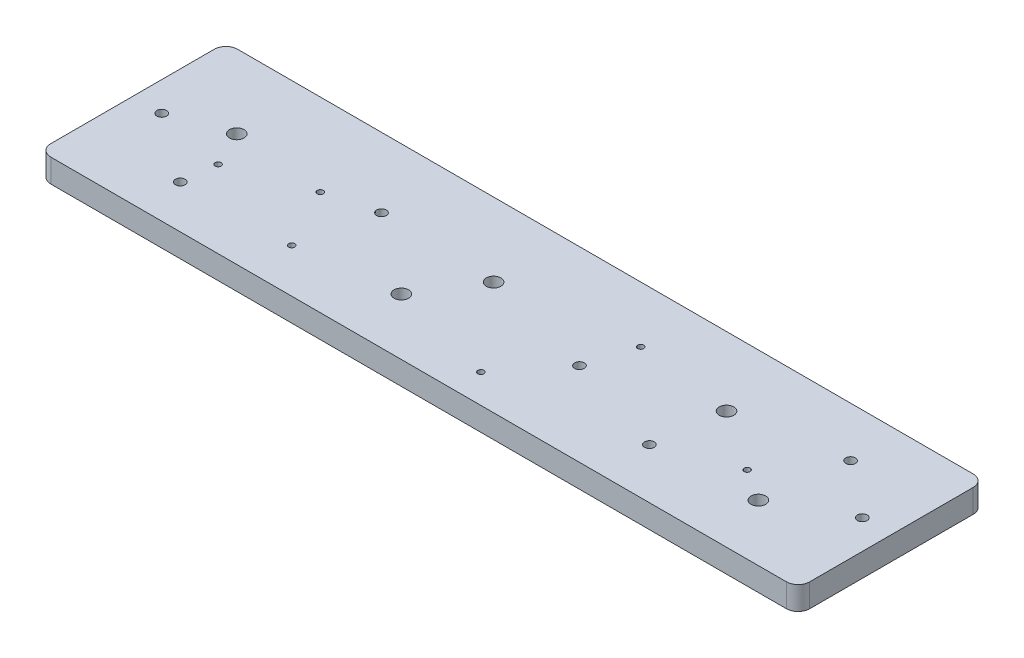
from build123d import *

# Parameters (mm, degrees)
SKETCH1_W                    = 650
SKETCH1_H                    = 160
BOSS_EXTRUDE1_DEPTH          = 20
FILLET1_R                    = 10
F_12_5_12_5_DIAMETER_HOLE1_D = 12.5
F_8_3_8_3_DIAMETER_HOLE1_D   = 8.3
F_5_2_5_2_DIAMETER_HOLE1_D   = 5.2
M8_CLEARANCE_HOLE1_D         = 8.4


with BuildPart() as part:
    # Sketch1 → Boss-Extrude1 (new body)
    with BuildSketch(Plane(origin=(0, 0, 0), x_dir=(1, 0, 0), z_dir=(0, 1, 0))):
        with Locations((325, 80)):
            Rectangle(SKETCH1_W, SKETCH1_H)
    extrude(amount=BOSS_EXTRUDE1_DEPTH)

    # Fillet1
    fillet1_edges = [part.edges().sort_by_distance(p)[0] for p in [
        (0, 10, 0),
        (650, 10, 0),
        (650, 10, -160),
        (0, 10, -160),
    ]]
    fillet(fillet1_edges, radius=FILLET1_R)

    # Ø12.5 (12.5) Diameter Hole1 (through all)
    with Locations(Plane(origin=(0, 20, 0), x_dir=(1, 0, 0), z_dir=(0, 1, 0))):
        with Locations((72.352582635, 96.89911856), (261.667898073, 48.548804186), (487.756692049, 100.98506062), (567.432562216, 48.548804186), (292.312463521, 96.89911856)):
            Hole(F_12_5_12_5_DIAMETER_HOLE1_D / 2)

    # Ø8.3 (8.3) Diameter Hole1 (through all)
    with Locations(Plane(origin=(0, 20, 0), x_dir=(1, 0, 0), z_dir=(0, 1, 0))):
        with Locations((192.887873399, 100.304070277), (83.929418471, 36.97196835), (391.0560633, 71.702475858), (577.647417365, 117.32882886), (479.58480793, 43.10088144)):
            Hole(F_8_3_8_3_DIAMETER_HOLE1_D / 2)

    # Ø5.2 (5.2) Diameter Hole1 (through all)
    with Locations(Plane(origin=(0, 20, 0), x_dir=(1, 0, 0), z_dir=(0, 1, 0))):
        with Locations((178.58707619, 37.652958693), (151.347462458, 89.408224784), (353.601594419, 24.71414217), (403.31388948, 111.880906113), (540.192948484, 66.254553112), (87.007836042, 66.254553112)):
            Hole(F_5_2_5_2_DIAMETER_HOLE1_D / 2)

    # M8 Clearance Hole1 (through all)
    with Locations(Plane(origin=(0, 20, 0), x_dir=(1, 0, 0), z_dir=(0, 1, 0))):
        with Locations((625, 80), (25, 80)):
            Hole(M8_CLEARANCE_HOLE1_D / 2)


solid = part.part
